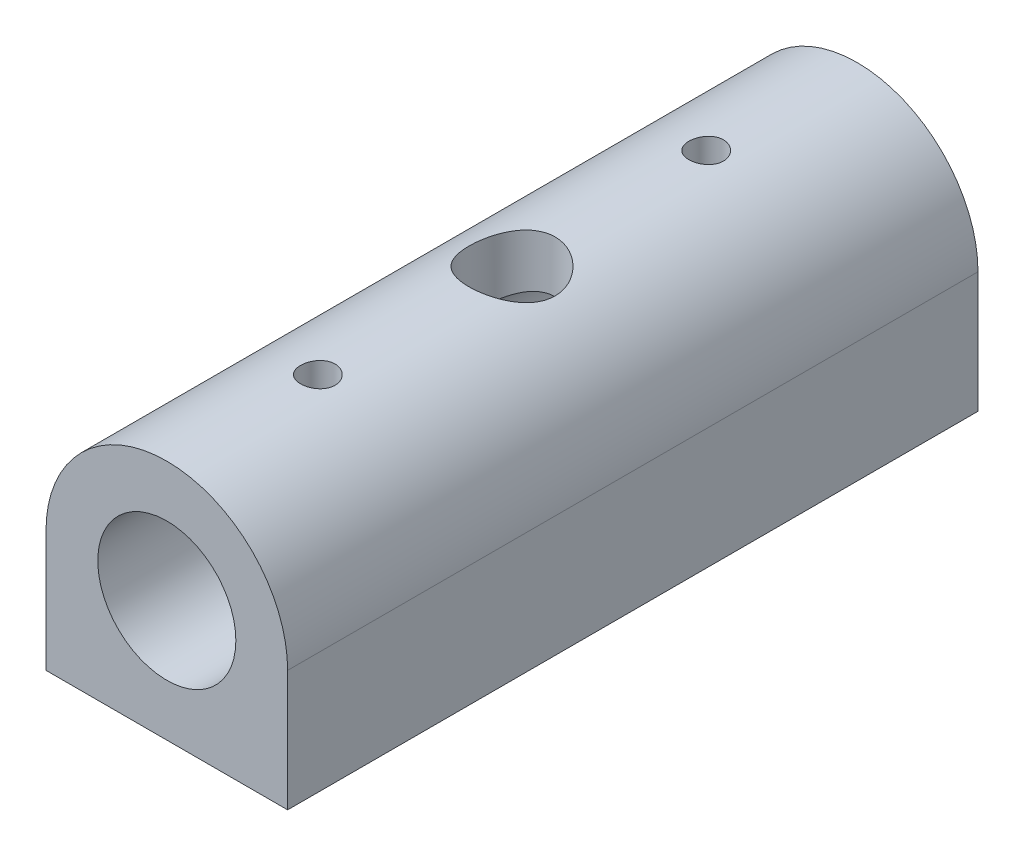
from build123d import *

# Parameters (mm, degrees)
SKETCH1_R           = 4
BOSS_EXTRUDE1_DEPTH = 20
SKETCH2_R           = 2.5
CUT_EXTRUDE1_DEPTH  = 26.396850198
SKETCH3_R           = 1
CUT_EXTRUDE2_DEPTH  = 23.315913757


with BuildPart() as part:
    # Sketch1 → Boss-Extrude1 (new, symmetric)
    with BuildSketch(Plane.XY):
        with BuildLine():
            Line((-7, 0), (-7, -7))
            Line((-7, -7), (7, -7))
            Line((7, -7), (7, 0))
            ThreePointArc((7, 0), (0, 7), (-7, 0))
        make_face()
        Circle(SKETCH1_R, mode=Mode.SUBTRACT)
    extrude(amount=BOSS_EXTRUDE1_DEPTH, both=True)

    # Sketch2 → Cut-Extrude1 (cut, through all)
    with BuildSketch(Plane(origin=(0, -7, 0), x_dir=(-1, 0, 0), z_dir=(0, -1, 0))):
        with Locations(Location((0, 0, 0), (0, 0, 180))):
            Circle(SKETCH2_R)
    extrude(amount=-CUT_EXTRUDE1_DEPTH, mode=Mode.SUBTRACT)

    # Sketch3 → Cut-Extrude2 (cut, through all)
    with BuildSketch(Plane(origin=(0, 0, 0), x_dir=(1, 0, 0), z_dir=(0, 1, 0))):
        with Locations(Location((0, 11.25, 0), (0, 0, 90))):
            Circle(SKETCH3_R)
        with Locations(Location((0, -11.25, 0), (0, 0, 90))):
            Circle(SKETCH3_R)
    extrude(amount=CUT_EXTRUDE2_DEPTH, mode=Mode.SUBTRACT)


solid = part.part
